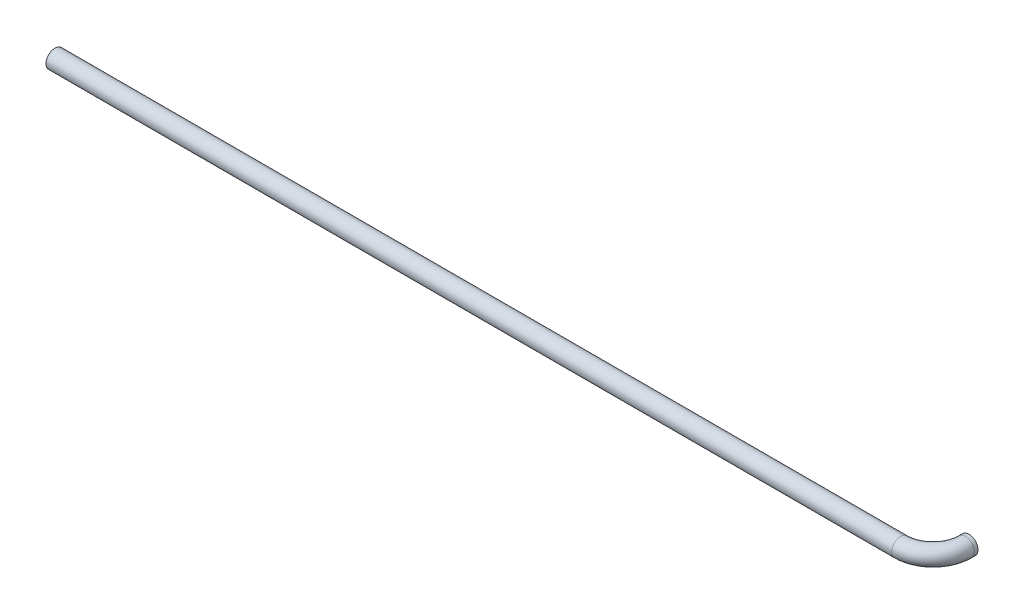
from build123d import *

# Parameters (mm, degrees)
SKIZZE1_R                       = 1.25
SKIZZE1_R_2                     = 1
AUFSATZ_LINEAR_AUSTRAGEN1_DEPTH = 58.5
SKIZZE2_R                       = 1.25
SKIZZE2_R_2                     = 1


with BuildPart() as part:
    # Skizze1 → Aufsatz-Linear austragen1 (new, symmetric)
    with BuildSketch(Plane(origin=(0, 0, 0), x_dir=(0, 0, -1), z_dir=(1, 0, 0))):
        Circle(SKIZZE1_R)
        Circle(SKIZZE1_R_2, mode=Mode.SUBTRACT)
    extrude(amount=AUFSATZ_LINEAR_AUSTRAGEN1_DEPTH, both=True)

    # Austragung1: sweep along a path in Skizze3
    with BuildLine(Plane(origin=(0, 0, 0), x_dir=(1, 0, 0), z_dir=(0, 1, 0))) as austragung1_path:
        Line((58.5, 0), (59, 0))
        ThreePointArc((59, 0), (62.181980515, 1.318019485), (63.5, 4.5))
        Line((63.5, 4.5), (63.5, 5))
    # Skizze2 → Austragung1 (sweep)
    with BuildSketch(Plane(origin=(58.5, 0, 0), x_dir=(0, 0, -1), z_dir=(1, 0, 0))):
        Circle(SKIZZE2_R)
        Circle(SKIZZE2_R_2, mode=Mode.SUBTRACT)
    sweep(path=austragung1_path.line)


solid = part.part
